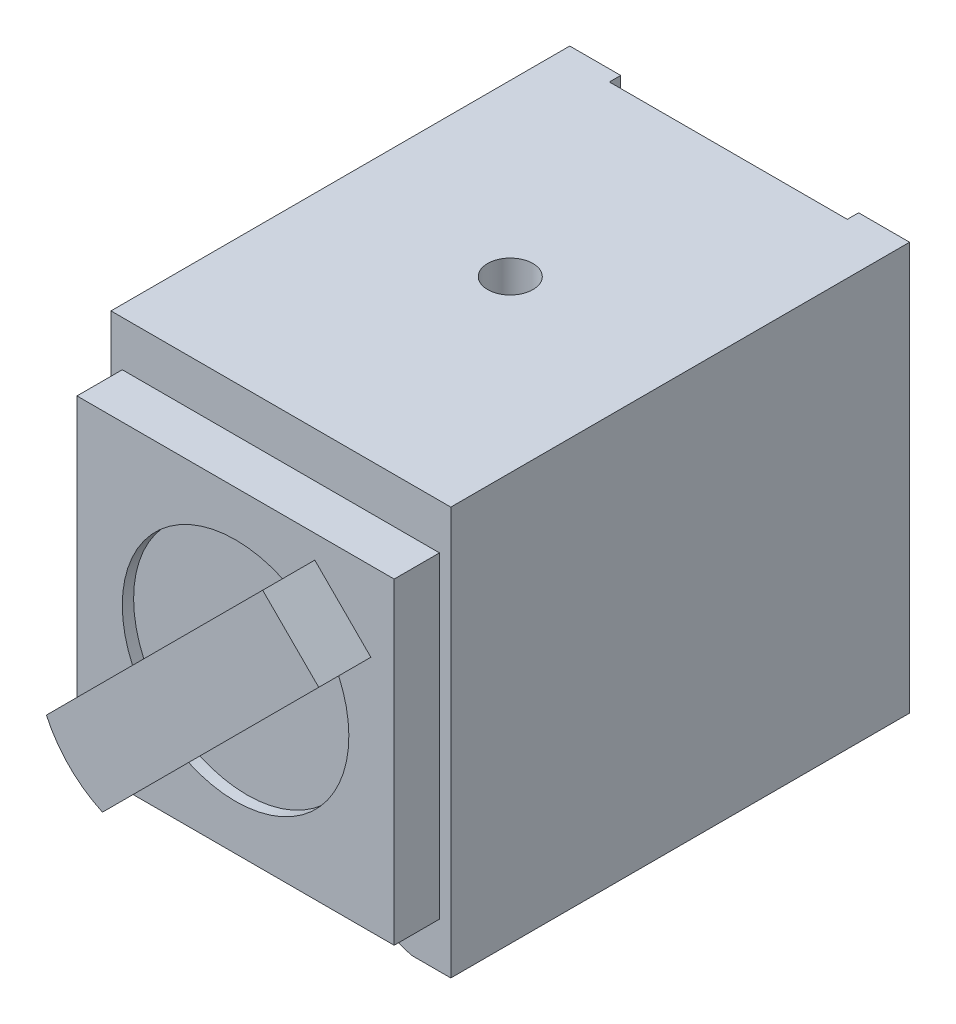
from build123d import *

# Parameters (mm, degrees)
SKETCH_1_W          = 30
SKETCH_1_H          = 40.5
EXTRUDE_1_DEPTH     = 36
SKETCH_2_W          = 28
SKETCH_2_H          = 28
EXTRUDE_2_DEPTH     = 4
SKETCH_3_R          = 10
CUT_EXTRUDE_1_DEPTH = 1
EXTRUDE_START       = 4
EXTRUDE_3_DEPTH     = 4
EXTRUDE_START_2     = 4.6
EXTRUDE_4_DEPTH     = 4.6
SKETCH_7_W          = 21
SKETCH_7_H          = 1
CUT_EXTRUDE_2_DEPTH = 51.352979058
CUT_EXTRUDE_3_DEPTH = 57.224994442
SKETCH_9_R          = 2
CUT_EXTRUDE_4_DEPTH = 6.5


with BuildPart() as part:
    # 草图1 → 凸台-拉伸1 (new body)
    with BuildSketch(Plane(origin=(0, 0, 0), x_dir=(1, 0, 0), z_dir=(0, 1, 0))):
        Rectangle(SKETCH_1_W, SKETCH_1_H)
    extrude(amount=EXTRUDE_1_DEPTH)

    # 草图2 → 凸台-拉伸2 (add)
    with BuildSketch(Plane.XY.offset(20.25)):
        with Locations((0, 18)):
            Rectangle(SKETCH_2_W, SKETCH_2_H)
    extrude(amount=EXTRUDE_2_DEPTH)

    # 草图3 → 切除-拉伸1 (cut)
    with BuildSketch(Plane.XY.offset(24.25)):
        with Locations((0, 18)):
            Circle(SKETCH_3_R)
    extrude(amount=-CUT_EXTRUDE_1_DEPTH, mode=Mode.SUBTRACT)

    # 草图5 → 凸台-拉伸3 (add)
    with BuildSketch(Plane.XY.offset(23.25).offset(EXTRUDE_START)):
        with BuildLine():
            Line((4.148946916, 27.098694384), (-9.098694384, 13.851053084))
            ThreePointArc((-9.098694384, 13.851053084), (-7.071067812, 10.928932188), (-4.148946916, 8.901305616))
            Line((-4.148946916, 8.901305616), (9.098694384, 22.148946916))
            ThreePointArc((9.098694384, 22.148946916), (7.071067812, 25.071067812), (4.148946916, 27.098694384))
        make_face()
    extrude(amount=-EXTRUDE_3_DEPTH)

    # 草图6 → 凸台-拉伸4 (add)
    with BuildSketch(Plane.XY.offset(27.25).offset(EXTRUDE_START_2)):
        with BuildLine():
            Line((-9.098694384, 13.851053084), (9.993188708, 32.942936176))
            Line((9.993188708, 32.942936176), (14.942936176, 27.993188708))
            Line((14.942936176, 27.993188708), (-4.148946916, 8.901305616))
            ThreePointArc((-4.148946916, 8.901305616), (-7.071067812, 10.928932188), (-9.098694384, 13.851053084))
        make_face()
    extrude(amount=-EXTRUDE_4_DEPTH)

    # 草图7 → 切除-拉伸2 (cut, through all)
    with BuildSketch(Plane(origin=(0, 36, 0), x_dir=(1, 0, 0), z_dir=(0, 1, 0))):
        with Locations((0, 19.75)):
            Rectangle(SKETCH_7_W, SKETCH_7_H)
    extrude(amount=-CUT_EXTRUDE_2_DEPTH, mode=Mode.SUBTRACT)

    # 草图8 → 切除-拉伸3 (cut, through all)
    with BuildSketch(Plane.XY.offset(20.25)):
        Polygon((-11.5, 0), (-3, 3), (3, 3), (11.5, 0), align=None)
    extrude(amount=-CUT_EXTRUDE_3_DEPTH, mode=Mode.SUBTRACT)

    # 草图9 → 切除-拉伸4 (cut)
    with BuildSketch(Plane(origin=(0, 36, 0), x_dir=(1, 0, 0), z_dir=(0, 1, 0))):
        with Locations(Location((0, 0, 0), (0, 0, 270))):
            Circle(SKETCH_9_R)
    extrude(amount=-CUT_EXTRUDE_4_DEPTH, mode=Mode.SUBTRACT)


solid = part.part
